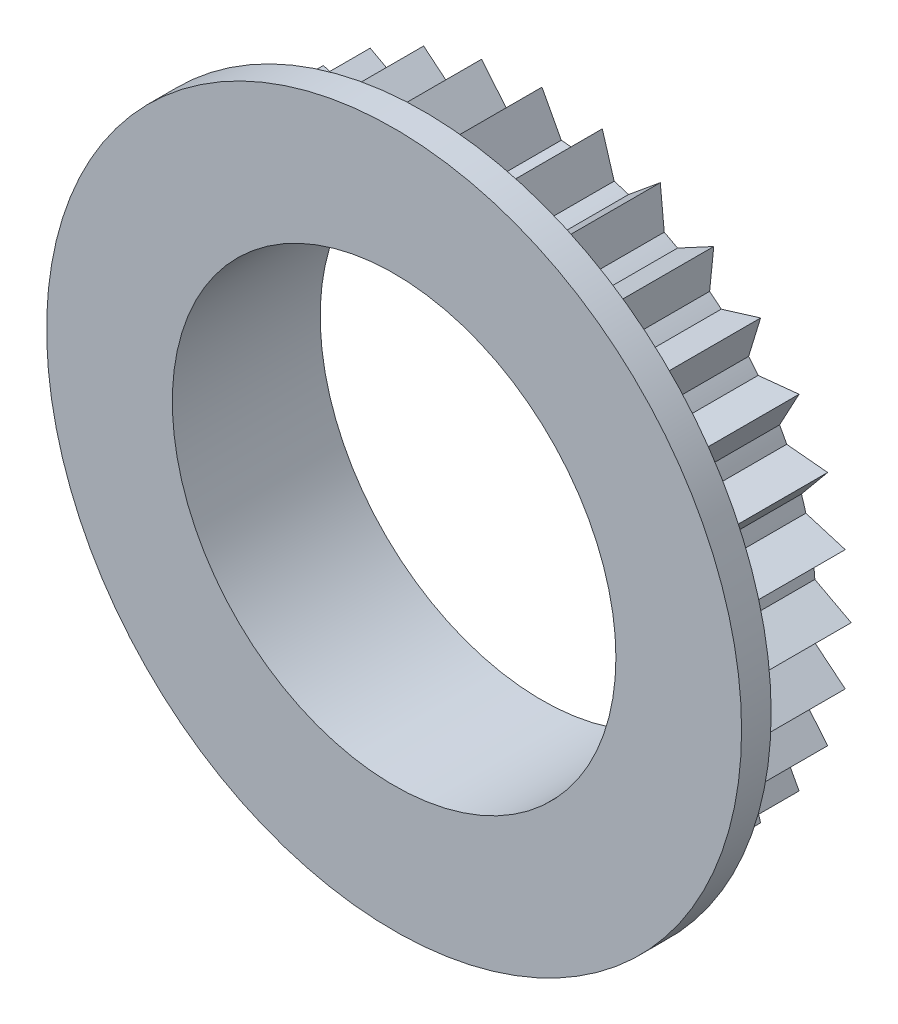
from build123d import *

# Parameters (mm, degrees)
BOSS_EXTRUDE1_DEPTH = 8
SKETCH3_R           = 23.5
BOSS_EXTRUDE2_DEPTH = 2
SKETCH5_R           = 15
CUT_EXTRUDE2_DEPTH  = 12


with BuildPart() as part:
    # Sketch1 → Boss-Extrude1 (new body)
    with BuildSketch(Plane.XY):
        with BuildLine():
            Line((0, 20.911393532), (1.305419533, 18.453885223))
            ThreePointArc((1.305419533, 18.453885223), (1.813317096, 18.410917443), (2.319838147, 18.353973711))
            Line((2.319838147, 18.353973711), (4.079610498, 20.509586969))
            Line((4.079610498, 20.509586969), (4.880510674, 17.844624276))
            ThreePointArc((4.880510674, 17.844624276), (5.370266529, 17.703396211), (5.855945749, 17.548729281))
            Line((5.855945749, 17.548729281), (8.002443852, 19.319608481))
            Line((8.002443852, 19.319608481), (8.268046526, 16.549604426))
            ThreePointArc((8.268046526, 16.549604426), (8.720839631, 16.31554339), (9.16701264, 16.069097027))
            Line((9.16701264, 16.069097027), (11.617747778, 17.387188273))
            Line((11.617747778, 17.387188273), (11.337845987, 14.618592558))
            ThreePointArc((11.337845987, 14.618592558), (11.736275757, 14.300693387), (12.125796376, 13.971938385))
            Line((12.125796376, 13.971938385), (14.786588171, 14.786588171))
            Line((14.786588171, 14.786588171), (13.971938385, 12.125796376))
            ThreePointArc((13.971938385, 12.125796376), (14.300693387, 11.736275757), (14.618592558, 11.337845987))
            Line((14.618592558, 11.337845987), (17.387188273, 11.617747778))
            Line((17.387188273, 11.617747778), (16.069097027, 9.16701264))
            ThreePointArc((16.069097027, 9.16701264), (16.31554339, 8.720839631), (16.549604426, 8.268046526))
            Line((16.549604426, 8.268046526), (19.319608481, 8.002443852))
            Line((19.319608481, 8.002443852), (17.548729281, 5.855945749))
            ThreePointArc((17.548729281, 5.855945749), (17.703396211, 5.370266529), (17.844624276, 4.880510674))
            Line((17.844624276, 4.880510674), (20.509586969, 4.079610498))
            Line((20.509586969, 4.079610498), (18.353973711, 2.319838147))
            ThreePointArc((18.353973711, 2.319838147), (18.410917443, 1.813317096), (18.453885223, 1.305419533))
            Line((18.453885223, 1.305419533), (20.911393532, 0))
            Line((20.911393532, 0), (18.453885223, -1.305419533))
            ThreePointArc((18.453885223, -1.305419533), (18.410917443, -1.813317096), (18.353973711, -2.319838147))
            Line((18.353973711, -2.319838147), (20.509586969, -4.079610498))
            Line((20.509586969, -4.079610498), (17.844624276, -4.880510674))
            ThreePointArc((17.844624276, -4.880510674), (17.703396211, -5.370266529), (17.548729281, -5.855945749))
            Line((17.548729281, -5.855945749), (19.319608481, -8.002443852))
            Line((19.319608481, -8.002443852), (16.549604426, -8.268046526))
            ThreePointArc((16.549604426, -8.268046526), (16.31554339, -8.720839631), (16.069097027, -9.16701264))
            Line((16.069097027, -9.16701264), (17.387188273, -11.617747778))
            Line((17.387188273, -11.617747778), (14.618592558, -11.337845987))
            ThreePointArc((14.618592558, -11.337845987), (14.300693387, -11.736275757), (13.971938385, -12.125796376))
            Line((13.971938385, -12.125796376), (14.786588171, -14.786588171))
            Line((14.786588171, -14.786588171), (12.125796376, -13.971938385))
            ThreePointArc((12.125796376, -13.971938385), (11.736275757, -14.300693387), (11.337845987, -14.618592558))
            Line((11.337845987, -14.618592558), (11.617747778, -17.387188273))
            Line((11.617747778, -17.387188273), (9.16701264, -16.069097027))
            ThreePointArc((9.16701264, -16.069097027), (8.720839631, -16.31554339), (8.268046526, -16.549604426))
            Line((8.268046526, -16.549604426), (8.002443852, -19.319608481))
            Line((8.002443852, -19.319608481), (5.855945749, -17.548729281))
            ThreePointArc((5.855945749, -17.548729281), (5.370266529, -17.703396211), (4.880510674, -17.844624276))
            Line((4.880510674, -17.844624276), (4.079610498, -20.509586969))
            Line((4.079610498, -20.509586969), (2.319838147, -18.353973711))
            ThreePointArc((2.319838147, -18.353973711), (1.813317096, -18.410917443), (1.305419533, -18.453885223))
            Line((1.305419533, -18.453885223), (0, -20.911393532))
            Line((0, -20.911393532), (-1.305419533, -18.453885223))
            ThreePointArc((-1.305419533, -18.453885223), (-1.813317096, -18.410917443), (-2.319838147, -18.353973711))
            Line((-2.319838147, -18.353973711), (-4.079610498, -20.509586969))
            Line((-4.079610498, -20.509586969), (-4.880510674, -17.844624276))
            ThreePointArc((-4.880510674, -17.844624276), (-5.370266529, -17.703396211), (-5.855945749, -17.548729281))
            Line((-5.855945749, -17.548729281), (-8.002443852, -19.319608481))
            Line((-8.002443852, -19.319608481), (-8.268046526, -16.549604426))
            ThreePointArc((-8.268046526, -16.549604426), (-8.720839631, -16.31554339), (-9.16701264, -16.069097027))
            Line((-9.16701264, -16.069097027), (-11.617747778, -17.387188273))
            Line((-11.617747778, -17.387188273), (-11.337845987, -14.618592558))
            ThreePointArc((-11.337845987, -14.618592558), (-11.736275757, -14.300693387), (-12.125796376, -13.971938385))
            Line((-12.125796376, -13.971938385), (-14.786588171, -14.786588171))
            Line((-14.786588171, -14.786588171), (-13.971938385, -12.125796376))
            ThreePointArc((-13.971938385, -12.125796376), (-14.300693387, -11.736275757), (-14.618592558, -11.337845987))
            Line((-14.618592558, -11.337845987), (-17.387188273, -11.617747778))
            Line((-17.387188273, -11.617747778), (-16.069097027, -9.16701264))
            ThreePointArc((-16.069097027, -9.16701264), (-16.31554339, -8.720839631), (-16.549604426, -8.268046526))
            Line((-16.549604426, -8.268046526), (-19.319608481, -8.002443852))
            Line((-19.319608481, -8.002443852), (-17.548729281, -5.855945749))
            ThreePointArc((-17.548729281, -5.855945749), (-17.703396211, -5.370266529), (-17.844624276, -4.880510674))
            Line((-17.844624276, -4.880510674), (-20.509586969, -4.079610498))
            Line((-20.509586969, -4.079610498), (-18.353973711, -2.319838147))
            ThreePointArc((-18.353973711, -2.319838147), (-18.410917443, -1.813317096), (-18.453885223, -1.305419533))
            Line((-18.453885223, -1.305419533), (-20.911393532, 0))
            Line((-20.911393532, 0), (-18.453885223, 1.305419533))
            ThreePointArc((-18.453885223, 1.305419533), (-18.410917443, 1.813317096), (-18.353973711, 2.319838147))
            Line((-18.353973711, 2.319838147), (-20.509586969, 4.079610498))
            Line((-20.509586969, 4.079610498), (-17.844624276, 4.880510674))
            ThreePointArc((-17.844624276, 4.880510674), (-17.703396211, 5.370266529), (-17.548729281, 5.855945749))
            Line((-17.548729281, 5.855945749), (-19.319608481, 8.002443852))
            Line((-19.319608481, 8.002443852), (-16.549604426, 8.268046526))
            ThreePointArc((-16.549604426, 8.268046526), (-16.31554339, 8.720839631), (-16.069097027, 9.16701264))
            Line((-16.069097027, 9.16701264), (-17.387188273, 11.617747778))
            Line((-17.387188273, 11.617747778), (-14.618592558, 11.337845987))
            ThreePointArc((-14.618592558, 11.337845987), (-14.300693387, 11.736275757), (-13.971938385, 12.125796376))
            Line((-13.971938385, 12.125796376), (-14.786588171, 14.786588171))
            Line((-14.786588171, 14.786588171), (-12.125796376, 13.971938385))
            ThreePointArc((-12.125796376, 13.971938385), (-11.736275757, 14.300693387), (-11.337845987, 14.618592558))
            Line((-11.337845987, 14.618592558), (-11.617747778, 17.387188273))
            Line((-11.617747778, 17.387188273), (-9.16701264, 16.069097027))
            ThreePointArc((-9.16701264, 16.069097027), (-8.720839631, 16.31554339), (-8.268046526, 16.549604426))
            Line((-8.268046526, 16.549604426), (-8.002443852, 19.319608481))
            Line((-8.002443852, 19.319608481), (-5.855945749, 17.548729281))
            ThreePointArc((-5.855945749, 17.548729281), (-5.370266529, 17.703396211), (-4.880510674, 17.844624276))
            Line((-4.880510674, 17.844624276), (-4.079610498, 20.509586969))
            Line((-4.079610498, 20.509586969), (-2.319838147, 18.353973711))
            ThreePointArc((-2.319838147, 18.353973711), (-1.813317096, 18.410917443), (-1.305419533, 18.453885223))
            Line((-1.305419533, 18.453885223), (0, 20.911393532))
        make_face()
    extrude(amount=BOSS_EXTRUDE1_DEPTH)

    # Sketch3 → Boss-Extrude2 (add)
    with BuildSketch(Plane.XY.offset(8)):
        Circle(SKETCH3_R)
    extrude(amount=BOSS_EXTRUDE2_DEPTH)

    # Sketch5 → Cut-Extrude2 (cut)
    with BuildSketch(Plane.XY.offset(10)):
        Circle(SKETCH5_R)
    extrude(amount=-CUT_EXTRUDE2_DEPTH, mode=Mode.SUBTRACT)


solid = part.part
